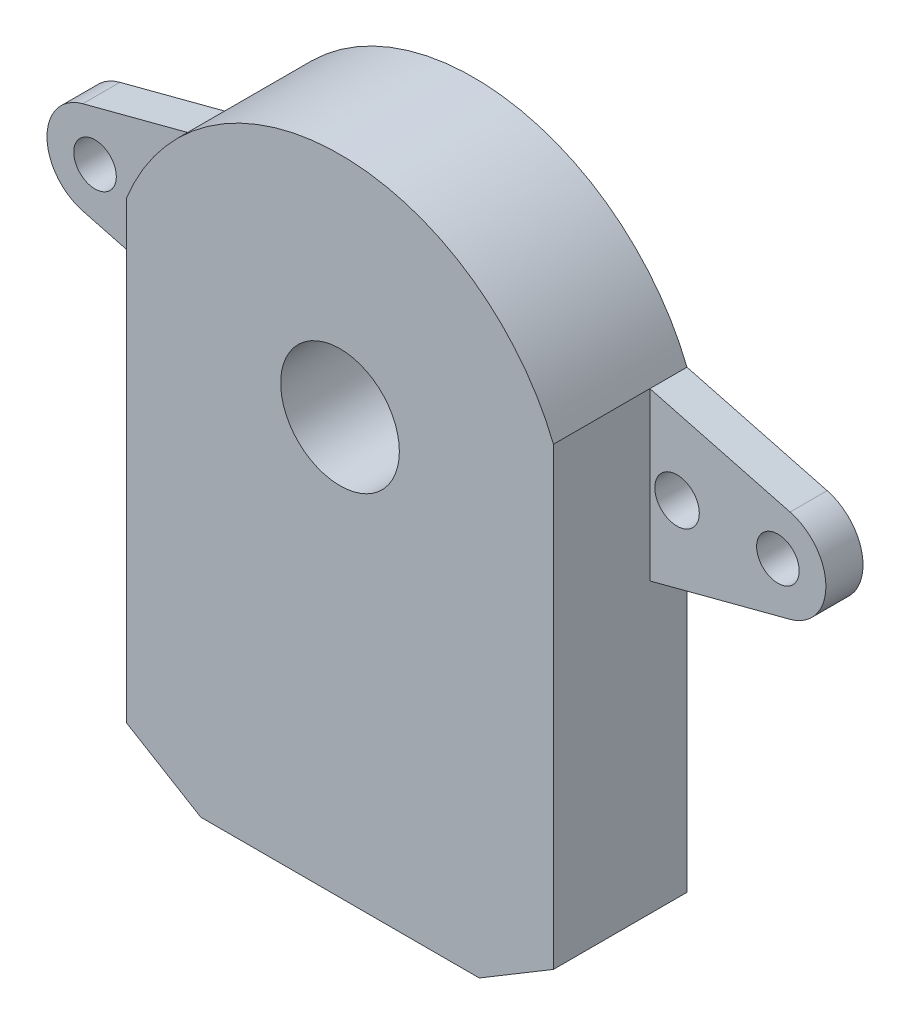
from build123d import *

# Parameters (mm, degrees)
SKETCH_1_R          = 4
SKETCH_1_R_2        = 1.435
SKETCH_1_R_3        = 1.5
EXTRUDE_1_DEPTH     = 9
CUT_EXTRUDE_START   = -6.5
CUT_EXTRUDE_1_DEPTH = 6.5
CHAMFER_1_SIZE      = 5
CHAMFER_1_SIZE2     = 3
CHAMFER_2_SIZE      = 3
CHAMFER_2_SIZE2     = 5


with BuildPart() as part:
    # ｽｹｯﾁ1 → ﾎﾞｽ - 押し出し1 (new body)
    with BuildSketch(Plane.XY):
        with BuildLine():
            Line((14.385, -28.04), (-14.385, -28.04))
            Line((-14.385, -28.04), (-14.385, -5.612501624))
            Line((-14.385, -5.612501624), (-23.834680852, -3.131361508))
            ThreePointArc((-23.834680852, -3.131361508), (-26.25, 0), (-23.834680852, 3.131361508))
            Line((-23.834680852, 3.131361508), (-14.385, 5.612501624))
            ThreePointArc((-14.385, 5.612501624), (0, 15.34), (14.385, 5.612501624))
            Line((14.385, 5.612501624), (23.834680852, 3.131361508))
            ThreePointArc((23.834680852, 3.131361508), (26.25, 0), (23.834680852, -3.131361508))
            Line((23.834680852, -3.131361508), (14.385, -5.612501624))
            Line((14.385, -5.612501624), (14.385, -28.04))
        make_face()
        Circle(SKETCH_1_R, mode=Mode.SUBTRACT)
        with Locations((-23.0125, 0)):
            Circle(SKETCH_1_R_2, mode=Mode.SUBTRACT)
        with Locations((23.0125, 0)):
            Circle(SKETCH_1_R_2, mode=Mode.SUBTRACT)
        with Locations((-16.215, 0)):
            Circle(SKETCH_1_R_3, mode=Mode.SUBTRACT)
        with Locations(Location((16.215, 0, 0), (0, 0, 180))):
            Circle(SKETCH_1_R_3, mode=Mode.SUBTRACT)
    extrude(amount=EXTRUDE_1_DEPTH)

    # ｽｹｯﾁ2 → ｶｯﾄ - 押し出し1 (cut)
    with BuildSketch(Plane.XY.offset(9).offset(CUT_EXTRUDE_START)):
        with BuildLine():
            Line((-14.385, 5.612501624), (-23.834680852, 3.131361508))
            ThreePointArc((-23.834680852, 3.131361508), (-26.25, 0), (-23.834680852, -3.131361508))
            Line((-23.834680852, -3.131361508), (-14.385, -5.612501624))
            Line((-14.385, -5.612501624), (-14.385, 5.612501624))
        make_face()
        with BuildLine():
            Line((14.385, -5.612501624), (14.385, 5.612501624))
            Line((14.385, 5.612501624), (23.834680852, 3.131361508))
            ThreePointArc((23.834680852, 3.131361508), (26.25, 0), (23.834680852, -3.131361508))
            Line((23.834680852, -3.131361508), (14.385, -5.612501624))
        make_face()
    extrude(amount=CUT_EXTRUDE_1_DEPTH, mode=Mode.SUBTRACT)

    # 面取り1
    chamfer_1_edges = [part.edges().sort_by_distance(p)[0] for p in [
        (14.385, -28.04, 4.5),
    ]]
    chamfer_1_side = [part.faces().sort_by_distance(p)[0] for p in [
        (0, -28.04, 4.5),
    ]]
    chamfer(chamfer_1_edges, length=CHAMFER_1_SIZE, length2=CHAMFER_1_SIZE2, reference=chamfer_1_side[0])

    # 面取り2
    chamfer_2_edges = [part.edges().sort_by_distance(p)[0] for p in [
        (-14.385, -28.04, 4.5),
    ]]
    chamfer_2_side = [part.faces().sort_by_distance(p)[0] for p in [
        (-14.385, -12.358852788, 4.831877112),
    ]]
    chamfer(chamfer_2_edges, length=CHAMFER_2_SIZE, length2=CHAMFER_2_SIZE2, reference=chamfer_2_side[0])


solid = part.part
